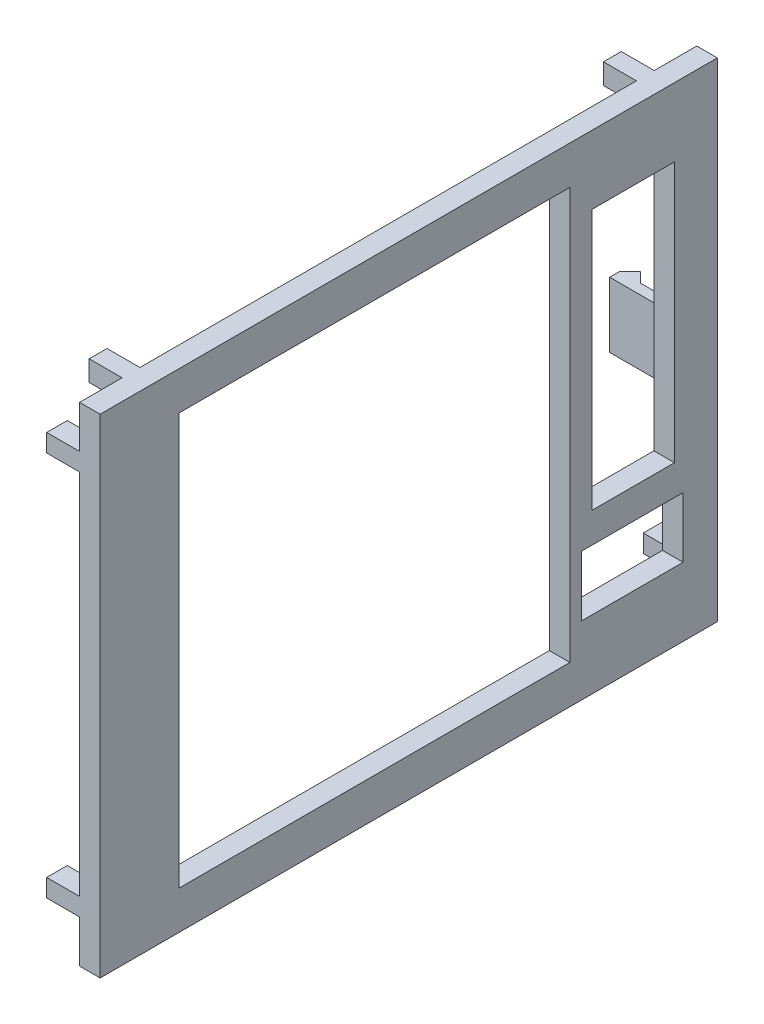
from build123d import *

# Parameters (mm, degrees)
SKETCH1_W           = 90
SKETCH1_H           = 71.2
BOSS_EXTRUDE1_DEPTH = 3
SKETCH2_W           = 3
SKETCH2_H           = 2.6
SKETCH2_W_2         = 2.6
SKETCH2_H_2         = 3
BOSS_EXTRUDE2_DEPTH = 4.8
CUT_EXTRUDE1_REACH  = 117.023
SKETCH4_W           = 57
SKETCH4_H           = 60
CUT_EXTRUDE2_REACH  = 117.023
SKETCH5_W           = 14.8
SKETCH5_H           = 8.8
SKETCH5_W_2         = 12
SKETCH5_H_2         = 38
SKETCH6_W           = 1.5
SKETCH6_H           = 9.5
BOSS_EXTRUDE3_DEPTH = 8
BOSS_EXTRUDE4_DEPTH = 9.5


with BuildPart() as part:
    # Sketch1 → Boss-Extrude1 (new body)
    with BuildSketch(Plane(origin=(0, 0, 0), x_dir=(0, 0, -1), z_dir=(1, 0, 0))):
        with Locations((45, 35.6)):
            Rectangle(SKETCH1_W, SKETCH1_H)
    extrude(amount=BOSS_EXTRUDE1_DEPTH)

    # Sketch2 → Boss-Extrude2 (add)
    with BuildSketch(Plane.ZY):
        with Locations((-88.5, 63.7)):
            Rectangle(SKETCH2_W, SKETCH2_H)
        with Locations((-82.5, 69.7)):
            Rectangle(SKETCH2_W_2, SKETCH2_H_2)
        with Locations((-7.5, 69.7)):
            Rectangle(SKETCH2_W_2, SKETCH2_H_2)
        with Locations((-1.5, 63.7)):
            Rectangle(SKETCH2_W, SKETCH2_H)
        with Locations((-1.5, 7.5)):
            Rectangle(SKETCH2_W, SKETCH2_H)
        with Locations((-7.5, 1.5)):
            Rectangle(SKETCH2_W_2, SKETCH2_H_2)
        with Locations((-88.5, 7.5)):
            Rectangle(SKETCH2_W, SKETCH2_H)
        with Locations((-82.5, 1.5)):
            Rectangle(SKETCH2_W_2, SKETCH2_H_2)
    extrude(amount=BOSS_EXTRUDE2_DEPTH)

    # Sketch4 → Cut-Extrude1 (cut, up to next)
    with BuildSketch(Plane(origin=(3, 0, 0), x_dir=(0, 0, -1), z_dir=(1, 0, 0)), mode=Mode.PRIVATE) as cut_extrude1_sk1:
        with Locations((40, 35.6)):
            Rectangle(SKETCH4_W, SKETCH4_H)
    cut_extrude1_tool1 = extrude(cut_extrude1_sk1.sketch, amount=-CUT_EXTRUDE1_REACH, mode=Mode.PRIVATE) & part.part
    add(cut_extrude1_tool1.solids().sort_by_distance((3, 35.6, -40))[0], mode=Mode.SUBTRACT)

    # Sketch5 → Cut-Extrude2 (cut, up to next)
    with BuildSketch(Plane(origin=(3, 0, 0), x_dir=(0, 0, -1), z_dir=(1, 0, 0)), mode=Mode.PRIVATE) as cut_extrude2_sk1:
        with Locations((77.6, 14.4)):
            Rectangle(SKETCH5_W, SKETCH5_H)
    cut_extrude2_tool1 = extrude(cut_extrude2_sk1.sketch, amount=-CUT_EXTRUDE2_REACH, mode=Mode.PRIVATE) & part.part
    # Sketch5 → Cut-Extrude2 (cut, up to next)
    with BuildSketch(Plane(origin=(3, 0, 0), x_dir=(0, 0, -1), z_dir=(1, 0, 0)), mode=Mode.PRIVATE) as cut_extrude2_sk2:
        with Locations((77.75, 42.2)):
            Rectangle(SKETCH5_W_2, SKETCH5_H_2)
    cut_extrude2_tool2 = extrude(cut_extrude2_sk2.sketch, amount=-CUT_EXTRUDE2_REACH, mode=Mode.PRIVATE) & part.part
    add(cut_extrude2_tool1.solids().sort_by_distance((3, 14.4, -77.6))[0], mode=Mode.SUBTRACT)
    add(cut_extrude2_tool2.solids().sort_by_distance((3, 42.2, -77.75))[0], mode=Mode.SUBTRACT)

    # Sketch6 → Boss-Extrude3 (add)
    with BuildSketch(Plane.ZY):
        with Locations((-86.05, 35.6)):
            Rectangle(SKETCH6_W, SKETCH6_H)
    extrude(amount=BOSS_EXTRUDE3_DEPTH)

    # Sketch7 → Boss-Extrude4 (add)
    with BuildSketch(Plane.XZ.offset(-30.85)):
        Polygon((-8, -86.8), (-6.5, -88.3), (-5, -86.8), align=None)
    extrude(amount=-BOSS_EXTRUDE4_DEPTH)


solid = part.part
